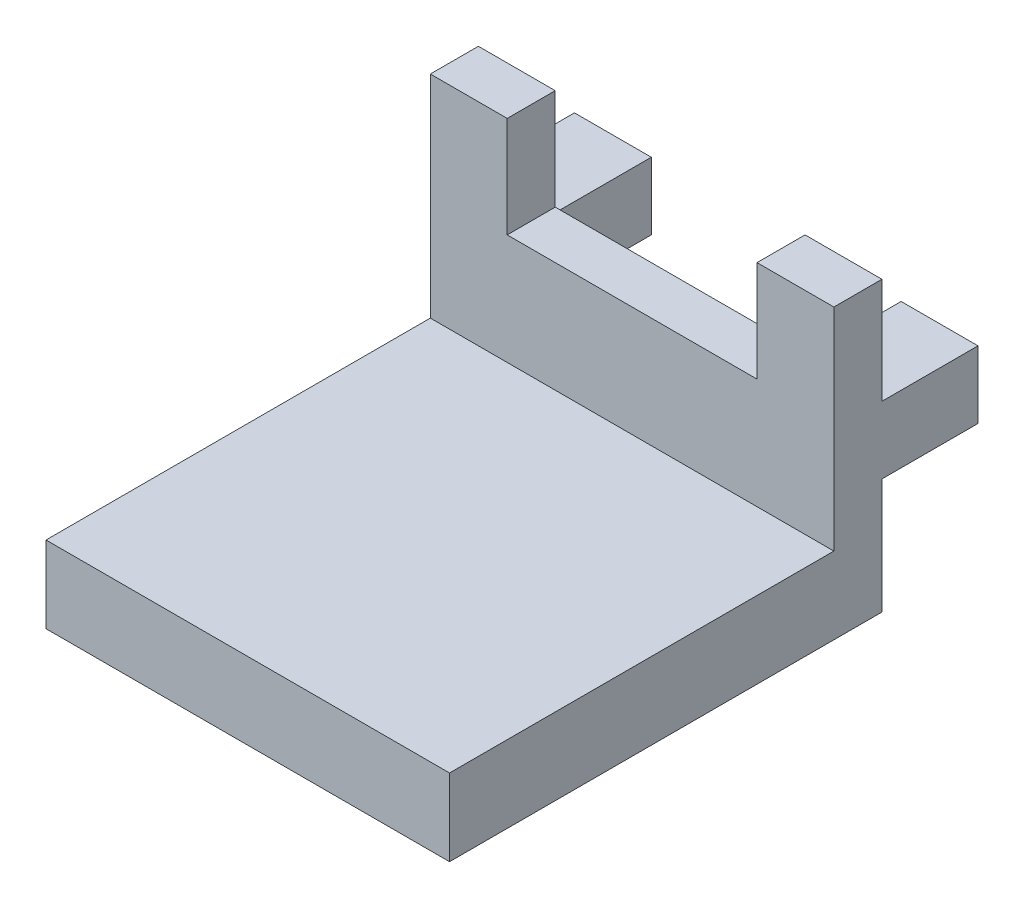
from build123d import *

# Parameters (mm, degrees)
BOSS_EXTRUDE1_DEPTH = 5
SKETCH2_W           = 8
SKETCH2_H           = 7
BOSS_EXTRUDE2_DEPTH = 10
SKETCH3_W           = 42
SKETCH3_H           = 8
BOSS_EXTRUDE3_DEPTH = 40


with BuildPart() as part:
    # Sketch1 → Boss-Extrude1 (new body)
    with BuildSketch(Plane.XY):
        Polygon((-17.516022594, -16.039535536), (24.483977406, -16.039535536), (24.483977406, 13.960464464), (16.483977406, 13.960464464), (16.483977406, 3.460464464), (-9.516022594, 3.460464464), (-9.516022594, 13.960464464), (-17.516022594, 13.960464464), align=None)
    extrude(amount=BOSS_EXTRUDE1_DEPTH)

    # Sketch2 → Boss-Extrude2 (add)
    with BuildSketch(Plane(origin=(0, 0, 0), x_dir=(-1, 0, 0), z_dir=(0, 0, -1))):
        with Locations((-20.483977406, -0.539535536)):
            Rectangle(SKETCH2_W, SKETCH2_H)
        with Locations((13.516022594, -0.539535536)):
            Rectangle(SKETCH2_W, SKETCH2_H)
    extrude(amount=BOSS_EXTRUDE2_DEPTH)

    # Sketch3 → Boss-Extrude3 (add)
    with BuildSketch(Plane.XY.offset(5)):
        with Locations((3.483977406, -12.039535536)):
            Rectangle(SKETCH3_W, SKETCH3_H)
    extrude(amount=BOSS_EXTRUDE3_DEPTH)


solid = part.part
